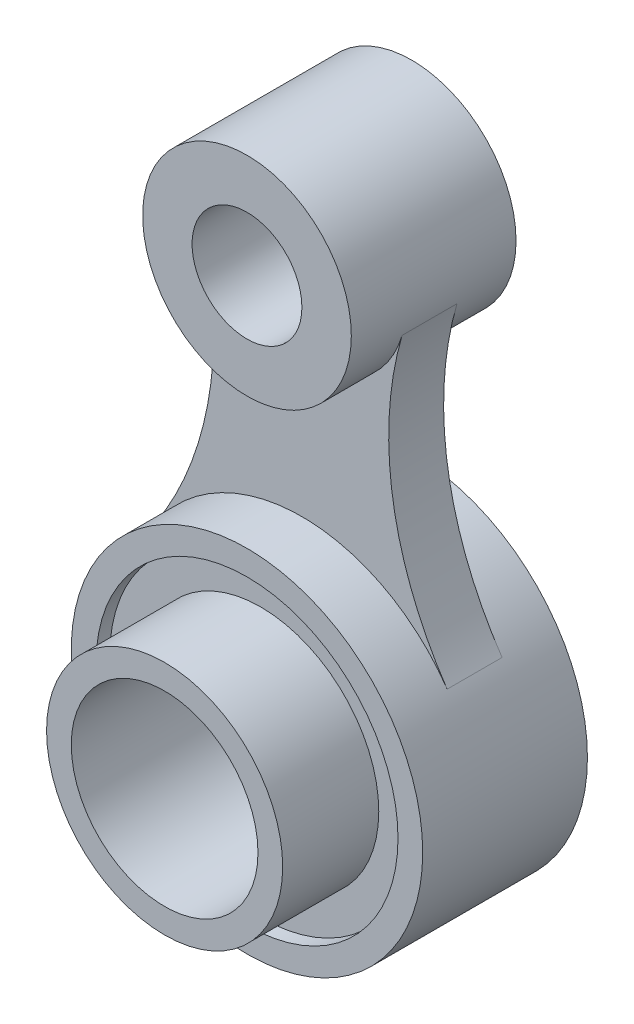
from build123d import *

# Parameters (mm, degrees)
BOSS_EXTRUDE1_DEPTH      = 5
SKETCH2_3_R              = 19
SKETCH2_3_R_2            = 10
BOSS_EXTRUDE2_DEPTH      = 15
SKETCH2_5_R              = 32
SKETCH2_5_R_2            = 27.5
BOSS_EXTRUDE3_DEPTH      = 15
BOSS_EXTRUDE4_DEPTH      = 30
BOSS_EXTRUDE4_DEPTH_BACK = 15
SKETCH2_6_R              = 21.5
SKETCH2_6_R_2            = 17
SKETCH2_7_R              = 27.5
SKETCH2_7_R_2            = 21.5
BOSS_EXTRUDE5_DEPTH      = 12.5


with BuildPart() as part:
    # Sketch2 → Boss-Extrude1 (new, symmetric)
    with BuildSketch(Plane.XY):
        with BuildLine():
            ThreePointArc((-18.724325041, 17.664638492), (7.753239465, 31.999343197), (34.412311606, 18.005092456))
            ThreePointArc((34.412311606, 18.005092456), (24.526384504, 42.934747234), (26.204222758, 69.700473468))
            ThreePointArc((26.204222758, 69.700473468), (7.817165129, 56.000523924), (-10.364391673, 69.972048465))
            ThreePointArc((-10.364391673, 69.972048465), (-8.883681263, 42.913636414), (-18.724325041, 17.664638492))
        make_face()
    extrude(amount=BOSS_EXTRUDE1_DEPTH, both=True)

    # Sketch2<3> → Boss-Extrude2 (add, symmetric)
    with BuildSketch(Plane.XY):
        with Locations((7.958263794, 75)):
            Circle(SKETCH2_3_R)
        with Locations((7.958263794, 75)):
            Circle(SKETCH2_3_R_2, mode=Mode.SUBTRACT)
    extrude(amount=BOSS_EXTRUDE2_DEPTH, both=True)

    # Sketch2<5> → Boss-Extrude3 (add, symmetric)
    with BuildSketch(Plane.XY):
        with Locations((7.958263794, 0)):
            Circle(SKETCH2_5_R)
        with Locations((7.958263794, 0)):
            Circle(SKETCH2_5_R_2, mode=Mode.SUBTRACT)
    extrude(amount=BOSS_EXTRUDE3_DEPTH, both=True)



with BuildPart() as body_2:
    # Sketch2<6> → Boss-Extrude4 (new, two sides: drawn at the far end of the back side and taken through both)
    with BuildSketch(Plane.XY.offset(-BOSS_EXTRUDE4_DEPTH_BACK)):
        with Locations((7.958263794, 0)):
            Circle(SKETCH2_6_R)
        with Locations((7.958263794, 0)):
            Circle(SKETCH2_6_R_2, mode=Mode.SUBTRACT)
    extrude(amount=BOSS_EXTRUDE4_DEPTH + BOSS_EXTRUDE4_DEPTH_BACK)


with BuildPart() as part_1:
    add(part.part)

    add(body_2.part)  # Boss-Extrude5 merges body 2
    # Sketch2<7> → Boss-Extrude5 (add, symmetric)
    with BuildSketch(Plane.XY):
        with Locations((7.958263794, 0)):
            Circle(SKETCH2_7_R)
        with Locations((7.958263794, 0)):
            Circle(SKETCH2_7_R_2, mode=Mode.SUBTRACT)
    extrude(amount=BOSS_EXTRUDE5_DEPTH, both=True)


solid = part_1.part
